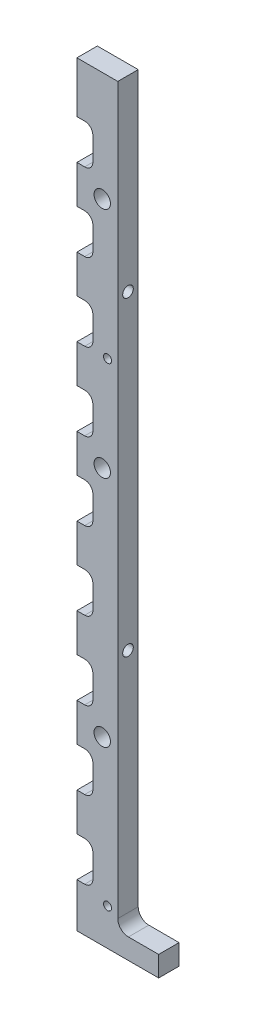
from build123d import *

# Parameters (mm, degrees)
SKETCH1_W              = 12.7
SKETCH1_H              = 234.95
BOSS_EXTRUDE1_DEPTH    = 3.175
SKETCH2_W              = 4.953
SKETCH2_H              = 12.319
CUT_EXTRUDE1_DEPTH     = 241.400131292
FILLET1_R              = 2.54
LPATTERN3_COUNT        = 9
LPATTERN3_PITCH        = 24.13
FILLET1_OF_LPATTERN3_R = 2.54
M4X0_7_TAPPED_HOLE1_D  = 3.3
BOSS_EXTRUDE2_START    = -3.175
SKETCH5_W              = 12.7
SKETCH5_H              = 6.35
BOSS_EXTRUDE2_DEPTH    = 6.35
M3X0_5_TAPPED_HOLE1_D  = 2.5
FILLET2_R              = 3.302
SKETCH8_R              = 2.5527
CUT_EXTRUDE2_DEPTH     = 241.463022105


with BuildPart() as part:
    # Sketch1 → Boss-Extrude1 (new, symmetric)
    with BuildSketch(Plane.XY):
        with Locations((-44.45, 117.475)):
            Rectangle(SKETCH1_W, SKETCH1_H)
    extrude(amount=BOSS_EXTRUDE1_DEPTH, both=True)

    # Sketch2 → Cut-Extrude1 (cut, symmetric)
    with BuildSketch(Plane.XY):
        with Locations((-48.3235, 19.91868)):
            Rectangle(SKETCH2_W, SKETCH2_H)
    cut_extrude1 = extrude(amount=CUT_EXTRUDE1_DEPTH, both=True, mode=Mode.SUBTRACT)

    # Fillet1
    fillet1_edges = [part.edges().sort_by_distance(p)[0] for p in [
        (-45.847, 26.07818, 0),
        (-45.847, 13.75918, 0),
    ]]
    fillet(fillet1_edges, radius=FILLET1_R)

    # LPattern3: Cut-Extrude1 ×9
    with Locations(*[(0, i * LPATTERN3_PITCH, 0) for i in range(1, LPATTERN3_COUNT)]):
        add(cut_extrude1, mode=Mode.SUBTRACT)

    # Fillet1 of LPattern3
    fillet1_of_lpattern3_edges = [part.edges().sort_by_distance(p)[0] for p in [
        (-45.847, 50.20818, 0),
        (-45.847, 37.88918, 0),
        (-45.847, 74.33818, 0),
        (-45.847, 62.01918, 0),
        (-45.847, 98.46818, 0),
        (-45.847, 86.14918, 0),
        (-45.847, 122.59818, 0),
        (-45.847, 110.27918, 0),
        (-45.847, 146.72818, 0),
        (-45.847, 134.40918, 0),
        (-45.847, 170.85818, 0),
        (-45.847, 158.53918, 0),
        (-45.847, 194.98818, 0),
        (-45.847, 182.66918, 0),
        (-45.847, 219.11818, 0),
        (-45.847, 206.79918, 0),
    ]]
    fillet(fillet1_of_lpattern3_edges, radius=FILLET1_OF_LPATTERN3_R)

    # M4x0.7 Tapped Hole1 (through all)
    with Locations(Plane.ZY.offset(50.8)):
        with Locations((0, 80.24368), (0, 176.76368)):
            Hole(M4X0_7_TAPPED_HOLE1_D / 2)

    # Sketch5 → Boss-Extrude2 (add)
    with BuildSketch(Plane.XY.offset(BOSS_EXTRUDE2_START)):
        with Locations((-31.75, 3.175)):
            Rectangle(SKETCH5_W, SKETCH5_H)
    extrude(amount=BOSS_EXTRUDE2_DEPTH)

    # M3x0.5 Tapped Hole1 (through all)
    with Locations(Plane.XY.offset(3.175)):
        with Locations((-41.275, 11.43), (-41.275, 158.75)):
            Hole(M3X0_5_TAPPED_HOLE1_D / 2)

    # Fillet2
    fillet2_edges = [part.edges().sort_by_distance(p)[0] for p in [
        (-38.1, 6.35, 0),
    ]]
    fillet(fillet2_edges, radius=FILLET2_R)

    # Sketch8 → Cut-Extrude2 (cut, through all)
    with BuildSketch(Plane.XY.offset(3.175)):
        with Locations((-42.926, 200.89368)):
            Circle(SKETCH8_R)
        with Locations((-42.926, 56.11368)):
            Circle(SKETCH8_R)
        with Locations((-42.926, 128.50368)):
            Circle(SKETCH8_R)
    extrude(amount=-CUT_EXTRUDE2_DEPTH, mode=Mode.SUBTRACT)


solid = part.part
